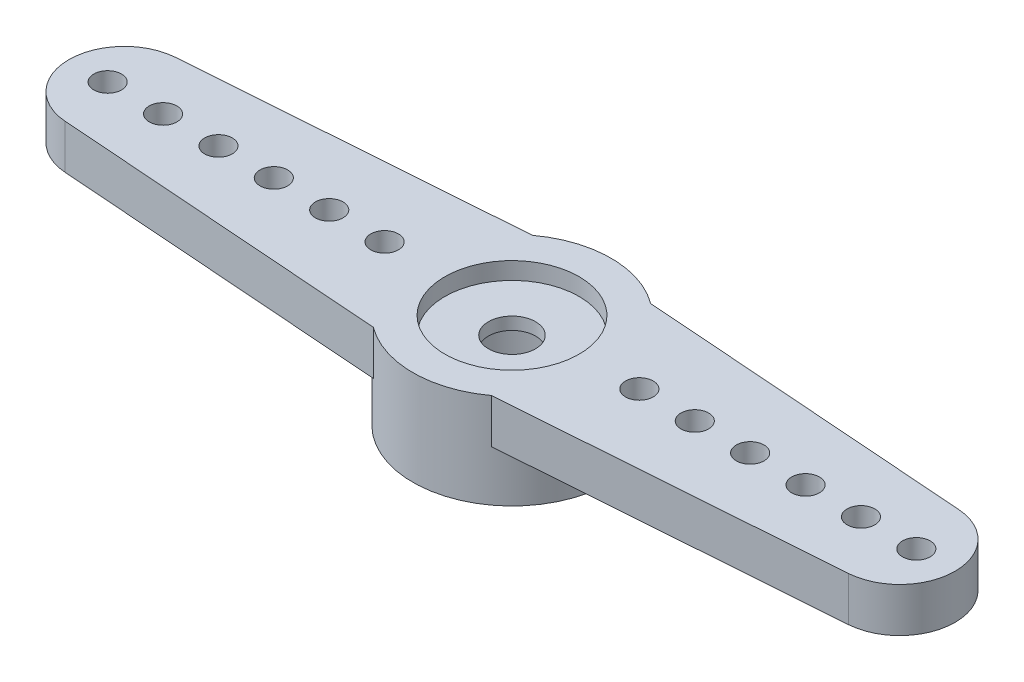
from build123d import *

# Parameters (mm, degrees)
SALIENTE_EXTRUIR1_DEPTH       = 1.6
CROQUIS2_R                    = 3.58
SALIENTE_EXTRUIR2_DEPTH       = 1.83
DI_METRO_DE_TALADRO_1_0_1_1_D = 1


with BuildPart() as part:
    # Croquis1 → Saliente-Extruir1 (new body)
    with BuildSketch(Plane(origin=(0, 14.27, 0), x_dir=(1, 0, 0), z_dir=(0, 1, 0))):
        with BuildLine():
            Line((8.033254556, 3.025), (20.046175024, 3.905348937))
            ThreePointArc((20.046175024, 3.905348937), (21.9, 5.9), (20.046175024, 7.894651063))
            Line((20.046175024, 7.894651063), (8.033254556, 8.775))
            ThreePointArc((8.033254556, 8.775), (5.9, 9.48), (3.766745444, 8.775))
            Line((3.766745444, 8.775), (-8.246175024, 7.894651063))
            ThreePointArc((-8.246175024, 7.894651063), (-10.1, 5.9), (-8.246175024, 3.905348937))
            Line((-8.246175024, 3.905348937), (3.766745444, 3.025))
            ThreePointArc((3.766745444, 3.025), (5.9, 2.32), (8.033254556, 3.025))
        make_face()
    extrude(amount=-SALIENTE_EXTRUIR1_DEPTH)

    # Croquis2 → Saliente-Extruir2 (add)
    with BuildSketch(Plane.XZ.offset(-12.67)):
        with Locations((5.9, -5.9)):
            Circle(CROQUIS2_R)
    extrude(amount=SALIENTE_EXTRUIR2_DEPTH)

    # Croquis3 → Cortar-Revolución1 (revolve, cut)
    with BuildSketch(Plane.XY.offset(-5.9)):
        Polygon((8.325, 14.27), (5.9, 14.27), (5.9, 10.84), (8.2, 10.84), (8.2, 13.2), (6.75, 13.2), (6.75, 13.65), (8.325, 13.65), align=None)
    revolve(axis=Axis((5.9, 14.27, -5.9), (0, -1, 0)), mode=Mode.SUBTRACT)

    # Diámetro de taladro Ø1.0 (1)1 (through all)
    with Locations(Plane(origin=(0, 12.67, 0), x_dir=(-1, 0, 0), z_dir=(0, -1, 0))):
        with Locations((2.7, 5.9), (6.7, 5.9), (8.7, 5.9), (4.7, 5.9), (0.7, 5.9), (-10.5, 5.9), (-14.5, 5.9), (-18.5, 5.9), (-20.5, 5.9), (-16.5, 5.9), (-12.5, 5.9), (-1.3, 5.9)):
            Hole(DI_METRO_DE_TALADRO_1_0_1_1_D / 2)


solid = part.part
